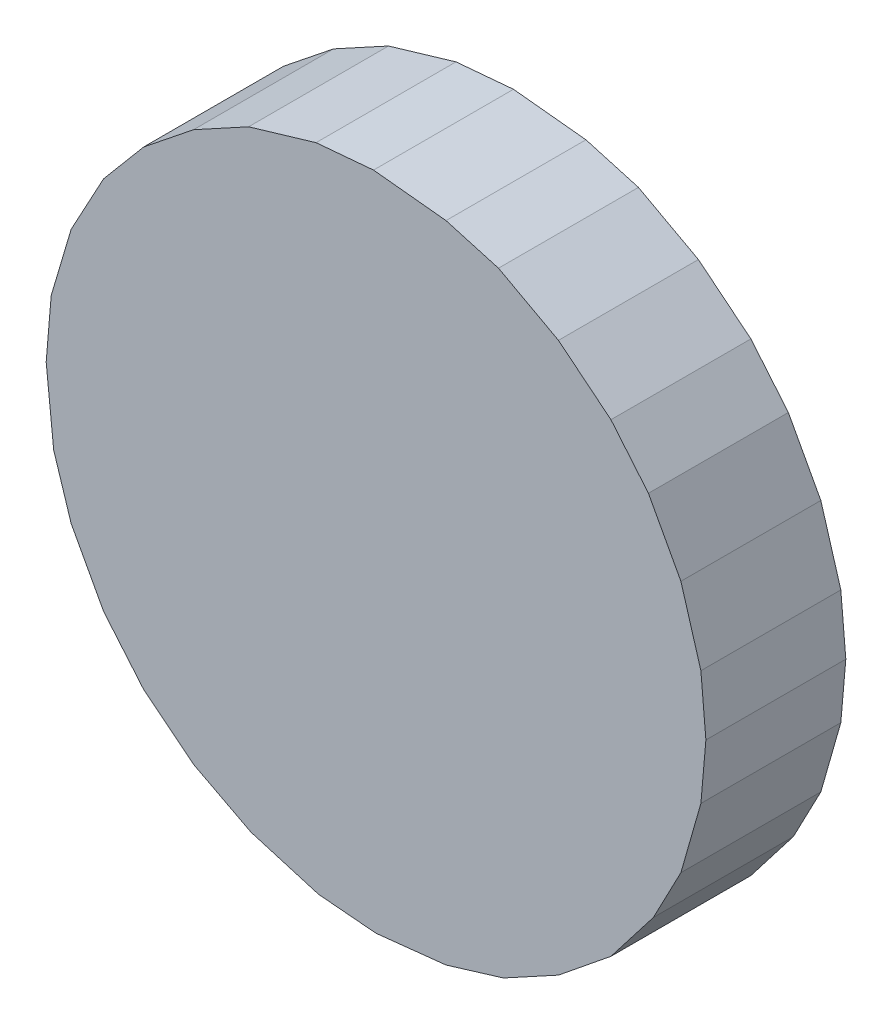
from build123d import *

# Parameters (mm, degrees)
COMPONENT_OUTLINE_DEPTH = 2.8


with BuildPart() as part:
    # 草图1 → Component_Outline (new body)
    with BuildSketch(Plane.XY):
        Polygon((0, -6.599975), (1.4, -6.449975), (2.55, -6.099975), (3.65, -5.499975), (4.7, -4.649975), (5.55, -3.549975), (6.1, -2.499975), (6.5, -1.099975), (6.6, 0.050025), (6.5, 1.200025), (6.1, 2.550025), (5.45, 3.750025), (4.7, 4.650025), (3.65, 5.500025), (2.45, 6.150025), (1.4, 6.450025), (-0.05, 6.600025), (-1.2, 6.500025), (-2.55, 6.100025), (-3.65, 5.500025), (-4.65, 4.700025), (-5.45, 3.750025), (-6.1, 2.550025), (-6.5, 1.200025), (-6.6, 2.5e-05), (-6.45, -1.449975), (-6.1, -2.549975), (-5.45, -3.749975), (-4.65, -4.699975), (-3.65, -5.499975), (-2.5, -6.099975), (-1.15, -6.499975), align=None)
    extrude(amount=COMPONENT_OUTLINE_DEPTH)


solid = part.part
